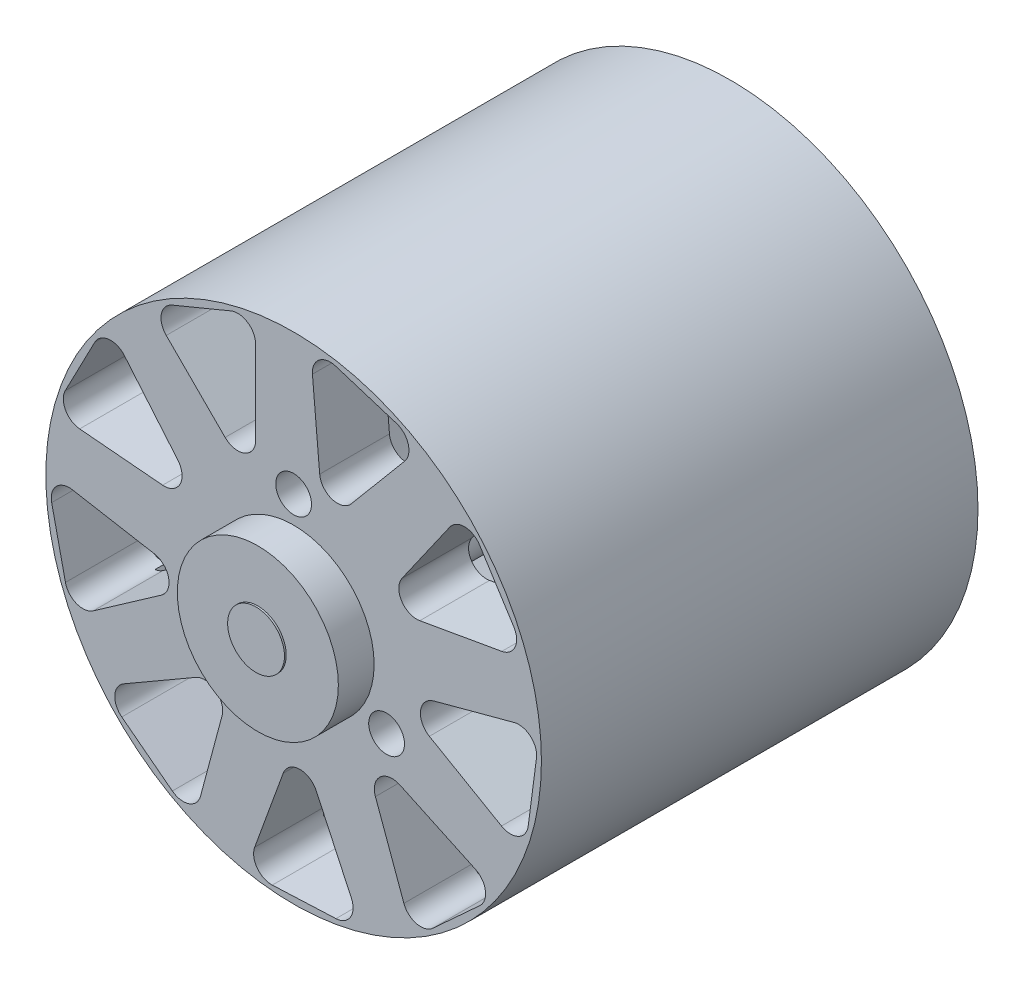
from build123d import *

# Parameters (mm, degrees)
SKETCH1_R                = 13.85
BOSS_EXTRUDE1_DEPTH      = 24.4
SKETCH2_R                = 12.85
CUT_EXTRUDE1_DEPTH       = 20.5
SKETCH3_R                = 1
CUT_EXTRUDE2_DEPTH       = 4.5
SKETCH4_R                = 4.5
BOSS_EXTRUDE2_DEPTH      = 2
BOSS_EXTRUDE3_DEPTH      = 0.1
BOSS_EXTRUDE3_DEPTH_BACK = 35
SKETCH5_R                = 1.5875


with BuildPart() as part:
    # Sketch1 → Boss-Extrude1 (new body)
    with BuildSketch(Plane.XY):
        Circle(SKETCH1_R)
    extrude(amount=BOSS_EXTRUDE1_DEPTH)

    # Sketch2 → Cut-Extrude1 (cut)
    with BuildSketch(Plane(origin=(0, 0, 0), x_dir=(-1, 0, 0), z_dir=(0, 0, -1))):
        Circle(SKETCH2_R)
    extrude(amount=-CUT_EXTRUDE1_DEPTH, mode=Mode.SUBTRACT)

    # Sketch3 → Cut-Extrude2 (cut)
    with BuildSketch(Plane.XY.offset(24.4)):
        with Locations((0, 6)):
            Circle(SKETCH3_R)
        with Locations((5.196152423, -3)):
            Circle(SKETCH3_R)
        with Locations((-5.196152423, -3)):
            Circle(SKETCH3_R)
        with BuildLine():
            Line((1.456483025, 7.691744175), (1.050821732, 12.328473971))
            ThreePointArc((1.050821732, 12.328473971), (1.421092958, 13.195514197), (2.347722229, 13.369346664))
            Line((2.347722229, 13.369346664), (5.745200753, 12.298125801))
            ThreePointArc((5.745200753, 12.298125801), (6.404544807, 11.624237864), (6.210539396, 10.70162124))
            Line((6.210539396, 10.70162124), (3.218722166, 7.136112308))
            ThreePointArc((3.218722166, 7.136112308), (2.151971923, 6.825182967), (1.456483025, 7.691744175))
        make_face()
        with BuildLine():
            Line((-2.121320344, 7.535533906), (-2.121320344, 12.189975257))
            ThreePointArc((-2.121320344, 12.189975257), (-2.565750111, 13.021444869), (-3.504003776, 13.113854789))
            Line((-3.504003776, 13.113854789), (-6.795190818, 11.75060048))
            ThreePointArc((-6.795190818, 11.75060048), (-7.393292666, 11.02181127), (-7.119614167, 10.119614167))
            Line((-7.119614167, 10.119614167), (-3.828427125, 6.828427125))
            ThreePointArc((-3.828427125, 6.828427125), (-2.738636911, 6.611654373), (-2.121320344, 7.535533906))
        make_face()
        with BuildLine():
            Line((6.05988858, 4.956008641), (8.729566463, 8.768703788))
            ThreePointArc((8.729566463, 8.768703788), (9.570533392, 9.194889379), (10.392109953, 8.73242696))
            Line((10.392109953, 8.73242696), (12.306161998, 5.727967071))
            ThreePointArc((12.306161998, 5.727967071), (12.378082031, 4.787920773), (11.63641873, 4.20585971))
            Line((11.63641873, 4.20585971), (7.052688802, 3.397624451))
            ThreePointArc((7.052688802, 3.397624451), (6.035649178, 3.845132596), (6.05988858, 4.956008641))
        make_face()
        with BuildLine():
            Line((7.82780492, -0.098698416), (12.323650028, 1.10595965))
            ThreePointArc((12.323650028, 1.10595965), (13.241814888, 0.891873631), (13.573913934, 0.009507632))
            Line((13.573913934, 0.009507632), (13.108933277, -3.52237111))
            ThreePointArc((13.108933277, -3.52237111), (12.559777106, -4.288717659), (11.617488416, -4.257870321))
            Line((11.617488416, -4.257870321), (7.586623965, -1.930649646))
            ThreePointArc((7.586623965, -1.930649646), (7.095179104, -0.93409805), (7.82780492, -0.098698416))
        make_face()
        with BuildLine():
            Line((5.933004342, -5.107223387), (10.151360783, -7.0742753))
            ThreePointArc((10.151360783, -7.0742753), (10.717104031, -7.828459701), (10.404332729, -8.717860424))
            Line((10.404332729, -8.717860424), (7.777888986, -11.124552702))
            ThreePointArc((7.777888986, -11.124552702), (6.864612886, -11.358617435), (6.162606158, -10.729295508))
            Line((6.162606158, -10.729295508), (4.57069346, -6.355551317))
            ThreePointArc((4.57069346, -6.355551317), (4.834795873, -5.276253837), (5.933004342, -5.107223387))
        make_face()
        with BuildLine():
            Line((1.262085094, -7.726021775), (3.229137007, -11.944378215))
            ThreePointArc((3.229137007, -11.944378215), (3.177741091, -12.885769735), (2.366448608, -13.366044698))
            Line((2.366448608, -13.366044698), (-1.192516003, -13.521432449))
            ThreePointArc((-1.192516003, -13.521432449), (-2.042579995, -13.113693876), (-2.175828011, -12.180364084))
            Line((-2.175828011, -12.180364084), (-0.583915313, -7.806619893))
            ThreePointArc((-0.583915313, -7.806619893), (0.31215792, -7.149591815), (1.262085094, -7.726021775))
        make_face()
        with BuildLine():
            Line((-3.999377796, -6.729728709), (-5.204035861, -11.225573817))
            ThreePointArc((-5.204035861, -11.225573817), (-5.848522222, -11.913684901), (-6.778723117, -11.760108112))
            Line((-6.778723117, -11.760108112), (-9.604929501, -9.59148368))
            ThreePointArc((-9.604929501, -9.59148368), (-9.994026995, -8.73272721), (-9.496168072, -7.932104935))
            Line((-9.496168072, -7.932104935), (-5.465303622, -5.60488426))
            ThreePointArc((-5.465303622, -5.60488426), (-4.356542193, -5.677556324), (-3.999377796, -6.729728709))
        make_face()
        with BuildLine():
            Line((-7.389487367, -2.584520788), (-11.202182514, -5.254198671))
            ThreePointArc((-11.202182514, -5.254198671), (-12.138196989, -5.367054496), (-12.752054958, -4.651486241))
            Line((-12.752054958, -4.651486241), (-13.523089739, -1.173573099))
            ThreePointArc((-13.523089739, -1.173573099), (-13.269157693, -0.265620429), (-12.373145554, 0.027674268))
            Line((-12.373145554, 0.027674268), (-7.789415626, -0.78056099))
            ThreePointArc((-7.789415626, -0.78056099), (-6.986767796, -1.54892913), (-7.389487367, -2.584520788))
        make_face()
        with BuildLine():
            Line((-7.321973674, 2.770013134), (-11.95870347, 3.175674427))
            ThreePointArc((-11.95870347, 3.175674427), (-12.748274483, 3.690880356), (-12.758558561, 4.633617738))
            Line((-12.758558561, 4.633617738), (-11.113645995, 7.793465378))
            ThreePointArc((-11.113645995, 7.793465378), (-10.335502037, 8.325773103), (-9.460590719, 7.974504374))
            Line((-9.460590719, 7.974504374), (-6.468773488, 4.408995442))
            ThreePointArc((-6.468773488, 4.408995442), (-6.347807098, 3.304459219), (-7.321973674, 2.770013134))
        make_face()
    extrude(amount=-CUT_EXTRUDE2_DEPTH, mode=Mode.SUBTRACT)

    # Sketch4 → Boss-Extrude2 (add)
    with BuildSketch(Plane.XY.offset(24.4)):
        Circle(SKETCH4_R)
    extrude(amount=BOSS_EXTRUDE2_DEPTH)

    # Sketch5 → Boss-Extrude3 (add, two sides: drawn at the far end of the back side and taken through both)
    with BuildSketch(Plane.XY.offset(26.4).offset(-BOSS_EXTRUDE3_DEPTH_BACK)):
        Circle(SKETCH5_R)
    extrude(amount=BOSS_EXTRUDE3_DEPTH + BOSS_EXTRUDE3_DEPTH_BACK)


solid = part.part
